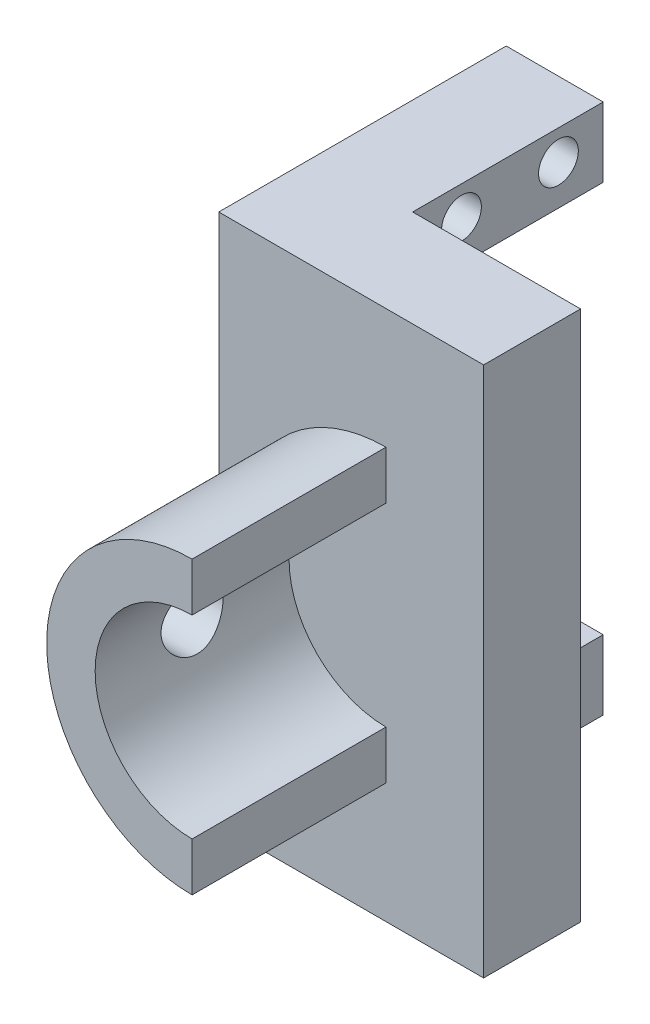
from build123d import *

# Parameters (mm, degrees)
BOSS_EXTRUDE1_DEPTH = 19.812
SKETCH2_R           = 3.175
CUT_EXTRUDE2_DEPTH  = 29.880704735
SKETCH3_W           = 34.1757
SKETCH3_H           = 54.2544
BOSS_EXTRUDE2_DEPTH = 9.906
SKETCH4_W           = 9.906
SKETCH4_H           = 7.112
BOSS_EXTRUDE3_DEPTH = 19.4691
SKETCH5_R           = 2.032
CUT_EXTRUDE3_DEPTH  = 53.599999528
SKETCH6_W           = 7.112
SKETCH6_H           = 54.2544
CUT_EXTRUDE4_DEPTH  = 44.715433515


with BuildPart() as part:
    # Sketch1 → Boss-Extrude1 (new body)
    with BuildSketch(Plane.XY):
        with BuildLine():
            Line((0, 14.859), (0, 9.906))
            ThreePointArc((0, 9.906), (-9.906, 0), (0, -9.906))
            Line((0, -9.906), (0, -14.859))
            ThreePointArc((0, -14.859), (-14.859, 0), (0, 14.859))
        make_face()
    extrude(amount=BOSS_EXTRUDE1_DEPTH)

    # Sketch2 → Cut-Extrude2 (cut, through all)
    with BuildSketch(Plane(origin=(0, 0, 0), x_dir=(0, 0, -1), z_dir=(1, 0, 0))):
        with Locations(Location((-9.906, 0, 0), (0, 0, 90))):
            Circle(SKETCH2_R)
    extrude(amount=-CUT_EXTRUDE2_DEPTH, mode=Mode.SUBTRACT)

    # Sketch3 → Boss-Extrude2 (add)
    with BuildSketch(Plane(origin=(0, 0, 0), x_dir=(-1, 0, 0), z_dir=(0, 0, -1))):
        Rectangle(SKETCH3_W, SKETCH3_H)
    extrude(amount=BOSS_EXTRUDE2_DEPTH)

    # Sketch4 → Boss-Extrude3 (add)
    with BuildSketch(Plane(origin=(0, 0, -9.906), x_dir=(-1, 0, 0), z_dir=(0, 0, -1))):
        with Locations((12.13485, -23.5712)):
            Rectangle(SKETCH4_W, SKETCH4_H)
        with Locations((12.13485, 23.5712)):
            Rectangle(SKETCH4_W, SKETCH4_H)
    extrude(amount=BOSS_EXTRUDE3_DEPTH)

    # Sketch5 → Cut-Extrude3 (cut, through all)
    with BuildSketch(Plane.ZY.offset(17.08785)):
        with Locations((-24.8031, 24.0792)):
            Circle(SKETCH5_R)
        with Locations((-14.8971, 24.0792)):
            Circle(SKETCH5_R)
        with Locations(Location((-14.8971, -24.0792, 0), (0, 0, 270))):
            Circle(SKETCH5_R)
        with Locations(Location((-24.8031, -24.0792, 0), (0, 0, 270))):
            Circle(SKETCH5_R)
    extrude(amount=-CUT_EXTRUDE3_DEPTH, mode=Mode.SUBTRACT)

    # Sketch6 → Cut-Extrude4 (cut, through all)
    with BuildSketch(Plane(origin=(0, 0, -9.906), x_dir=(-1, 0, 0), z_dir=(0, 0, -1))):
        with Locations((-13.53185, 0)):
            Rectangle(SKETCH6_W, SKETCH6_H)
    extrude(amount=-CUT_EXTRUDE4_DEPTH, mode=Mode.SUBTRACT)


solid = part.part
